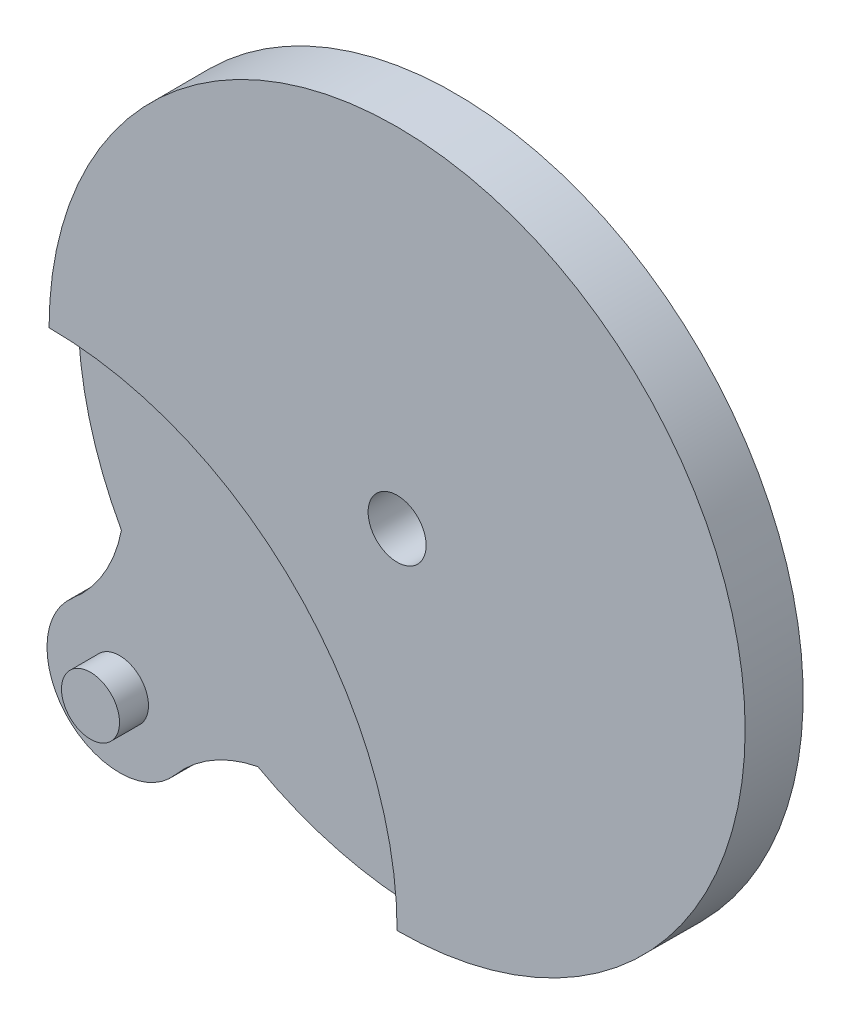
from build123d import *

# Parameters (mm, degrees)
SKICA1_R                 = 60
SKICA1_R_2               = 5
P_IDAT_VYSUNUT_M1_DEPTH  = 10
ODEBRAT_VYSUNUT_M1_DEPTH = 5
P_IDAT_VYSUNUT_M2_DEPTH  = 5
SKICA5_R                 = 5
P_IDAT_VYSUNUT_M3_DEPTH  = 5


with BuildPart() as part:
    # Skica1 → Přidat vysunutím1 (new body)
    with BuildSketch(Plane.XY):
        Circle(SKICA1_R)
        Circle(SKICA1_R_2, mode=Mode.SUBTRACT)
    extrude(amount=P_IDAT_VYSUNUT_M1_DEPTH)

    # Skica2 → Odebrat vysunutím1 (cut)
    with BuildSketch(Plane.XY.offset(10)):
        with BuildLine():
            Line((-60, 0), (-60, -60))
            Line((-60, -60), (0, -60))
            ThreePointArc((0, -60), (-17.573593129, -17.573593129), (-60, 0))
        make_face()
    extrude(amount=-ODEBRAT_VYSUNUT_M1_DEPTH, mode=Mode.SUBTRACT)

    # Skica4 → Přidat vysunutím2 (add)
    with BuildSketch(Plane(origin=(0, 0, 0), x_dir=(-1, 0, 0), z_dir=(0, 0, -1))):
        with BuildLine():
            ThreePointArc((29.001731724, -52.525227815), (42.426406871, -42.426406871), (52.525227815, -29.001731724))
            ThreePointArc((52.525227815, -29.001731724), (55.503659439, -36.872652673), (60.925083435, -43.309314338))
            ThreePointArc((60.925083435, -43.309314338), (61.695066659, -61.695066659), (43.309314338, -60.925083435))
            ThreePointArc((43.309314338, -60.925083435), (36.872652673, -55.503659439), (29.001731724, -52.525227815))
        make_face()
    extrude(amount=-P_IDAT_VYSUNUT_M2_DEPTH)

    # Skica5 → Přidat vysunutím3 (add)
    with BuildSketch(Plane.XY.offset(5)):
        with Locations(Location((-52.856231894, -52.856231894, 0), (0, 0, 180))):
            Circle(SKICA5_R)
    extrude(amount=P_IDAT_VYSUNUT_M3_DEPTH)


solid = part.part
